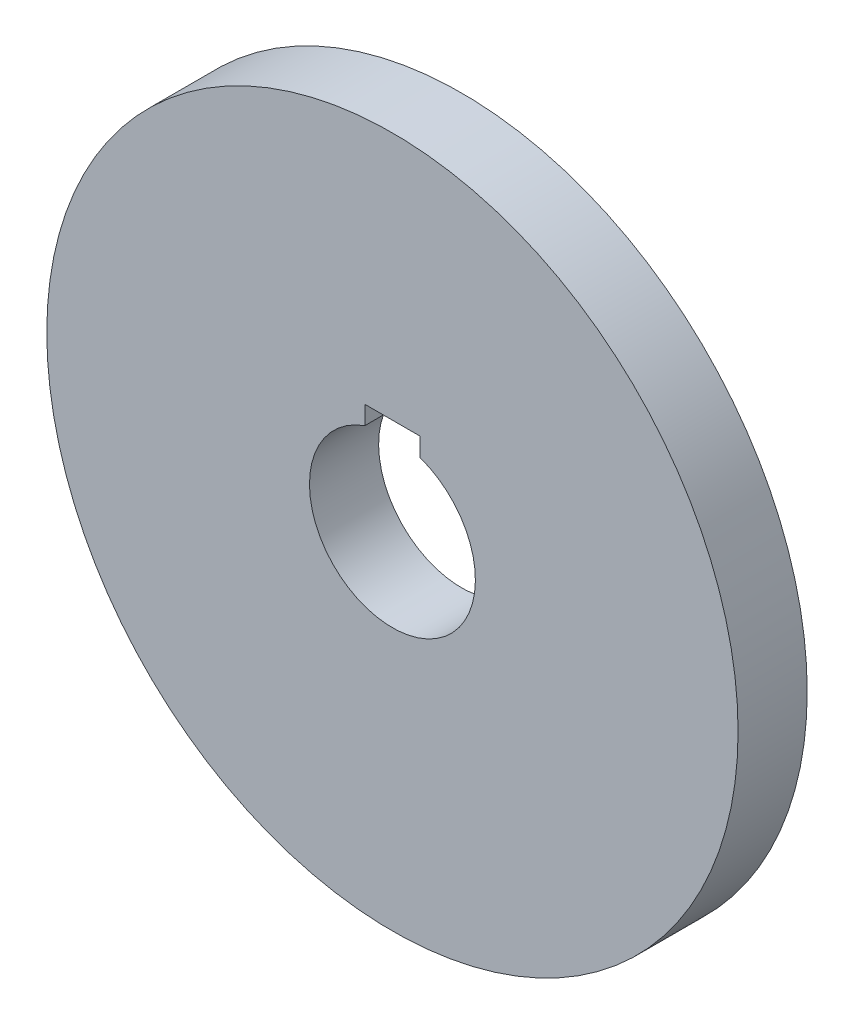
from build123d import *

# Parameters (mm, degrees)
SKETCH4_R           = 25
SKETCH4_R_2         = 6
BOSS_EXTRUDE1_DEPTH = 5
SKETCH5_W           = 4
SKETCH5_H           = 2
CUT_EXTRUDE1_DEPTH  = 5


with BuildPart() as part:
    # Sketch4 → Boss-Extrude1 (new body)
    with BuildSketch(Plane.XY):
        Circle(SKETCH4_R)
        Circle(SKETCH4_R_2, mode=Mode.SUBTRACT)
    extrude(amount=BOSS_EXTRUDE1_DEPTH)

    # Sketch5 → Cut-Extrude1 (cut)
    with BuildSketch(Plane.XY.offset(5)):
        with Locations((0, 6)):
            Rectangle(SKETCH5_W, SKETCH5_H)
    extrude(amount=-CUT_EXTRUDE1_DEPTH, mode=Mode.SUBTRACT)


solid = part.part
